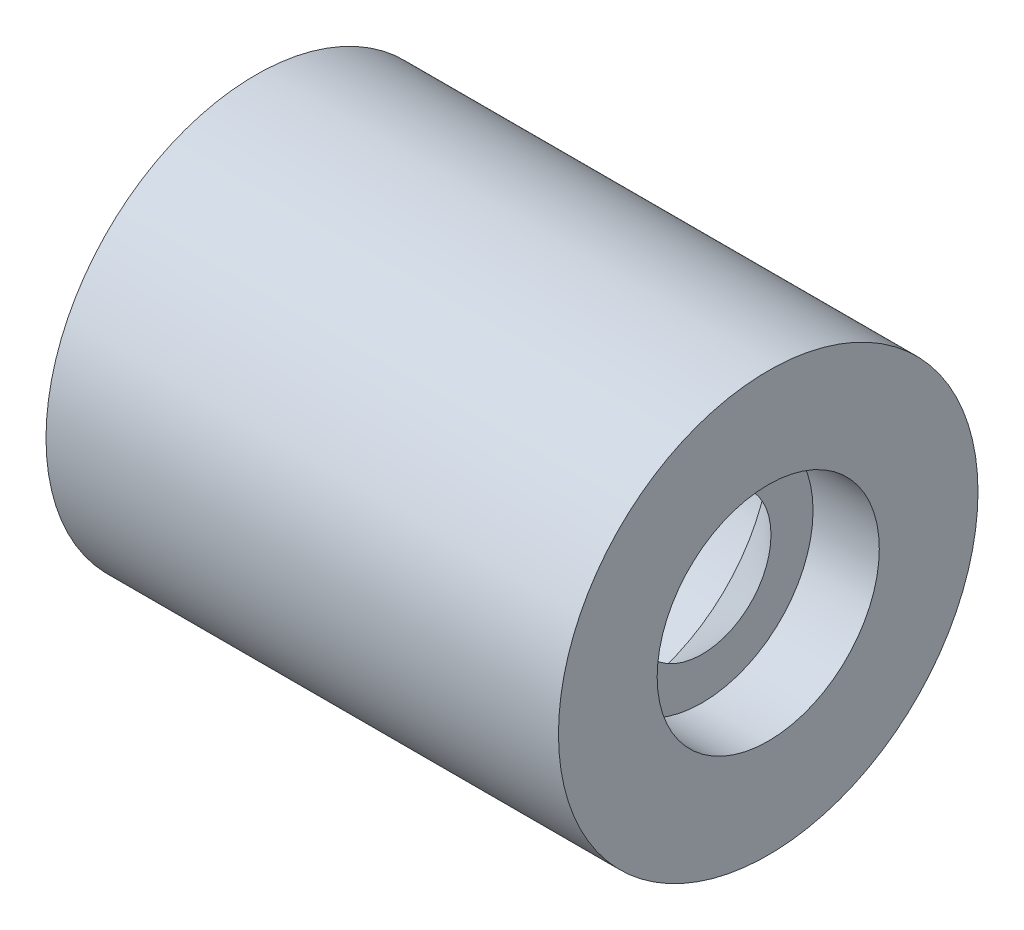
from build123d import *


with BuildPart() as part:
    # Sketch3 → Revolve1 (revolve)
    with BuildSketch(Plane.XY, mode=Mode.PRIVATE) as revolve1_sk:
        Polygon((1.798626967, 24.13), (-57.15, 24.13), (-57.15, 17.78), (-15.663873033, 17.78), (-5.821373033, 7.9375), (-5.821373033, 12.7762), (1.798626967, 12.7762), align=None)
    revolve(revolve1_sk.sketch.rotate(Axis((24.172114646, 0, 0), (-1, 0, 0)), 90), axis=Axis((24.172114646, 0, 0), (-1, 0, 0)))


solid = part.part
